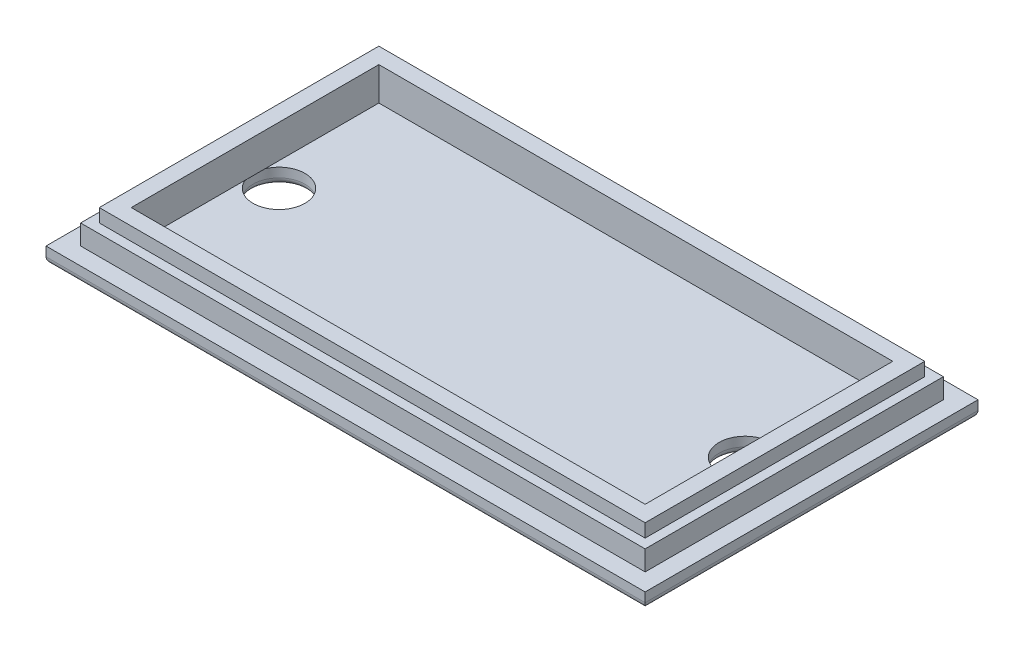
from build123d import *

# Parameters (mm, degrees)
SKETCH1_W                  = 45
SKETCH1_H                  = 1.2
BOSS_EXTRUDE1_DEPTH        = 25
SKETCH2_W                  = 42.4
SKETCH2_H                  = 22.4
SKETCH2_W_2                = 40.4
SKETCH2_H_2                = 20.4
EXTRUDE_THIN1_DEPTH        = 1.5
F_6_0_204_DIAMETER_HOLE1_D = 3.9
SKETCH6_W                  = 41
SKETCH6_H                  = 21
SKETCH6_W_2                = 38.6
SKETCH6_H_2                = 18.6
EXTRUDE_THIN2_DEPTH        = 2.5
FILLET1_R                  = 0.5


with BuildPart() as part:
    # Sketch1 → Boss-Extrude1 (new body)
    with BuildSketch(Plane.XY):
        with Locations((22.5, 0.6)):
            Rectangle(SKETCH1_W, SKETCH1_H)
    extrude(amount=-BOSS_EXTRUDE1_DEPTH)

    # Sketch2 → Extrude-Thin1 (add)
    with BuildSketch(Plane(origin=(0, 1.2, 0), x_dir=(1, 0, 0), z_dir=(0, 1, 0))):
        with Locations((22.5, 12.5)):
            Rectangle(SKETCH2_W, SKETCH2_H)
        with Locations((22.5, 12.5)):
            Rectangle(SKETCH2_W_2, SKETCH2_H_2, mode=Mode.SUBTRACT)
    extrude(amount=EXTRUDE_THIN1_DEPTH)

    # #6 (0.204) Diameter Hole1 (through all)
    with Locations(Plane(origin=(0, 0, 0), x_dir=(-1, 0, 0), z_dir=(0, -1, 0))):
        with Locations((-5, 12.5), (-40, 12.5)):
            Hole(F_6_0_204_DIAMETER_HOLE1_D / 2)

    # Sketch6 → Extrude-Thin2 (add)
    with BuildSketch(Plane(origin=(0, 1.2, 0), x_dir=(1, 0, 0), z_dir=(0, 1, 0))):
        with Locations((22.5, 12.5)):
            Rectangle(SKETCH6_W, SKETCH6_H)
        with Locations((22.5, 12.5)):
            Rectangle(SKETCH6_W_2, SKETCH6_H_2, mode=Mode.SUBTRACT)
    extrude(amount=EXTRUDE_THIN2_DEPTH)

    # Fillet1
    fillet1_edges = [part.edges().sort_by_distance(p)[0] for p in [
        (38.05, 0, -12.5),
        (3.05, 0, -12.5),
        (22.5, 0, 0),
        (45, 0, -12.5),
        (0, 0, -12.5),
        (22.5, 0, -25),
    ]]
    fillet(fillet1_edges, radius=FILLET1_R)


solid = part.part
